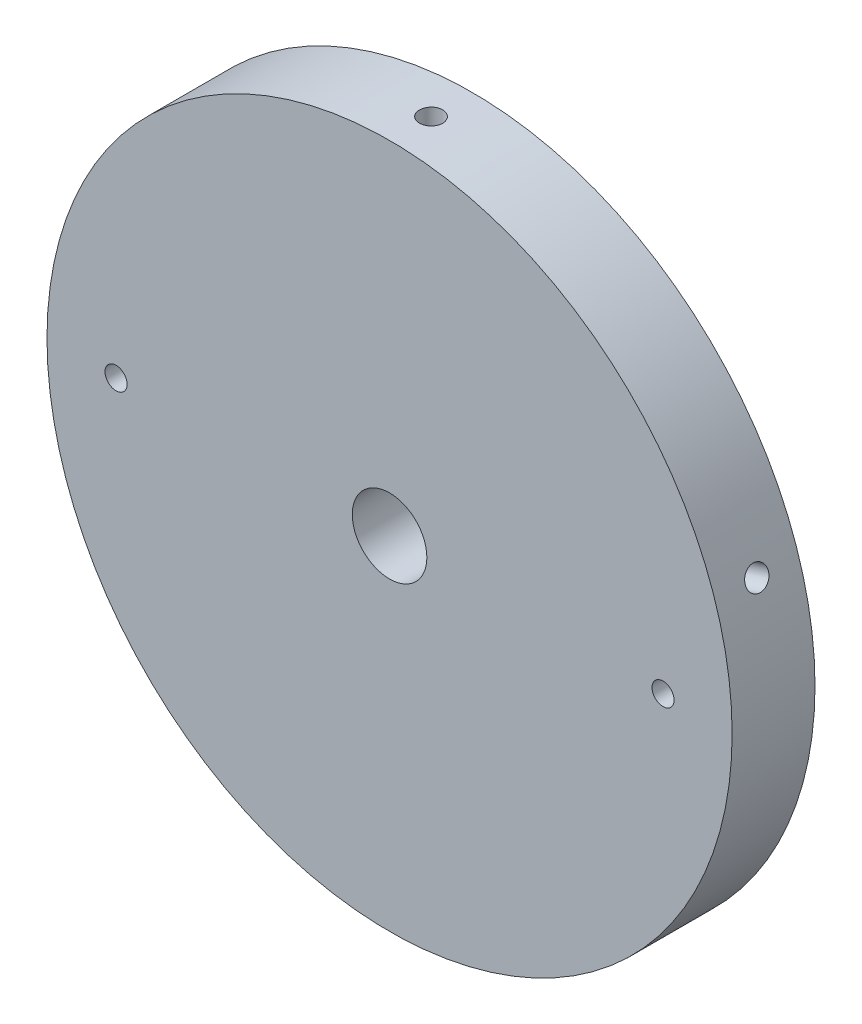
from build123d import *

# Parameters (mm, degrees)
SKETCH1_R                       = 62
BOSS_EXTRUDE1_DEPTH             = 15
M12_CLEARANCE_HOLE1_D           = 13.5
M5_TAPPED_HOLE1_D               = 4.2
M5_TAPPED_HOLE1_DEPTH           = 12.4
M5_TAPPED_HOLE1_TIP             = 1.2618073
M5_TAPPED_HOLE1_ON_FACE_2_D     = 4.2
M5_TAPPED_HOLE1_ON_FACE_2_DEPTH = 12.4
M5_TAPPED_HOLE1_ON_FACE_2_TIP   = 1.2618073
M5_TAPPED_HOLE1_ON_FACE_3_D     = 4.2
M5_TAPPED_HOLE1_ON_FACE_3_DEPTH = 12.4
M5_TAPPED_HOLE1_ON_FACE_3_TIP   = 1.2618073
M5_TAPPED_HOLE1_ON_FACE_4_D     = 4.2
M5_TAPPED_HOLE1_ON_FACE_4_DEPTH = 12.4
M5_TAPPED_HOLE1_ON_FACE_4_TIP   = 1.2618073
M5_TAPPED_HOLE1_ON_FACE_5_D     = 4.2
M5_TAPPED_HOLE1_ON_FACE_5_DEPTH = 12.4
M5_TAPPED_HOLE1_ON_FACE_5_TIP   = 1.2618073
SKETCH12_R                      = 2
CUT_EXTRUDE1_DEPTH              = 32


with BuildPart() as part:
    # Sketch1 → Boss-Extrude1 (new body)
    with BuildSketch(Plane.XY):
        Circle(SKETCH1_R)
    extrude(amount=BOSS_EXTRUDE1_DEPTH)

    # M12 Clearance Hole1 (through all)
    with Locations(Plane(origin=(0, 0, 0), x_dir=(-1, 0, 0), z_dir=(0, 0, -1))):
        with Locations((0, 0)):
            Hole(M12_CLEARANCE_HOLE1_D / 2)

    # M5 Tapped Hole1
    with Locations(Plane(origin=(0, 62, 7.5), x_dir=(1, 0, 0), z_dir=(0, 1, 0))):
        with Locations((0, 0)):
            Hole(M5_TAPPED_HOLE1_D / 2, depth=M5_TAPPED_HOLE1_DEPTH)
            with Locations((0, 0, -(M5_TAPPED_HOLE1_DEPTH + M5_TAPPED_HOLE1_TIP / 2))):  # 118° drill point
                Cone(0, M5_TAPPED_HOLE1_D / 2, M5_TAPPED_HOLE1_TIP, mode=Mode.SUBTRACT)

    # M5 Tapped Hole1 on face 2
    with Locations(Plane(origin=(58.96550401, 19.159053651, 7.5), x_dir=(-0.309016857306, 0.951056560832, 0), z_dir=(0.951056560832, 0.309016857306, 0))):
        with Locations((0, 0)):
            Hole(M5_TAPPED_HOLE1_ON_FACE_2_D / 2, depth=M5_TAPPED_HOLE1_ON_FACE_2_DEPTH)
            with Locations((0, 0, -(M5_TAPPED_HOLE1_ON_FACE_2_DEPTH + M5_TAPPED_HOLE1_ON_FACE_2_TIP / 2))):  # 118° drill point
                Cone(0, M5_TAPPED_HOLE1_ON_FACE_2_D / 2, M5_TAPPED_HOLE1_ON_FACE_2_TIP, mode=Mode.SUBTRACT)

    # M5 Tapped Hole1 on face 3
    with Locations(Plane(origin=(36.442685642, -50.159053651, 7.5), x_dir=(-0.809017116291, -0.58778508449, 0), z_dir=(0.58778508449, -0.809017116291, 0))):
        with Locations((0, 0)):
            Hole(M5_TAPPED_HOLE1_ON_FACE_3_D / 2, depth=M5_TAPPED_HOLE1_ON_FACE_3_DEPTH)
            with Locations((0, 0, -(M5_TAPPED_HOLE1_ON_FACE_3_DEPTH + M5_TAPPED_HOLE1_ON_FACE_3_TIP / 2))):  # 118° drill point
                Cone(0, M5_TAPPED_HOLE1_ON_FACE_3_D / 2, M5_TAPPED_HOLE1_ON_FACE_3_TIP, mode=Mode.SUBTRACT)

    # M5 Tapped Hole1 on face 4
    with Locations(Plane(origin=(-36.442685642, -50.159053651, 7.5), x_dir=(-0.809017116291, 0.58778508449, 0), z_dir=(-0.58778508449, -0.809017116291, 0))):
        with Locations((0, 0)):
            Hole(M5_TAPPED_HOLE1_ON_FACE_4_D / 2, depth=M5_TAPPED_HOLE1_ON_FACE_4_DEPTH)
            with Locations((0, 0, -(M5_TAPPED_HOLE1_ON_FACE_4_DEPTH + M5_TAPPED_HOLE1_ON_FACE_4_TIP / 2))):  # 118° drill point
                Cone(0, M5_TAPPED_HOLE1_ON_FACE_4_D / 2, M5_TAPPED_HOLE1_ON_FACE_4_TIP, mode=Mode.SUBTRACT)

    # M5 Tapped Hole1 on face 5
    with Locations(Plane(origin=(-58.96550401, 19.159053651, 7.5), x_dir=(-0.309016857306, -0.951056560832, 0), z_dir=(-0.951056560832, 0.309016857306, 0))):
        with Locations((0, 0)):
            Hole(M5_TAPPED_HOLE1_ON_FACE_5_D / 2, depth=M5_TAPPED_HOLE1_ON_FACE_5_DEPTH)
            with Locations((0, 0, -(M5_TAPPED_HOLE1_ON_FACE_5_DEPTH + M5_TAPPED_HOLE1_ON_FACE_5_TIP / 2))):  # 118° drill point
                Cone(0, M5_TAPPED_HOLE1_ON_FACE_5_D / 2, M5_TAPPED_HOLE1_ON_FACE_5_TIP, mode=Mode.SUBTRACT)

    # Sketch12 → Cut-Extrude1 (cut)
    with BuildSketch(Plane(origin=(0, 0, 0), x_dir=(-1, 0, 0), z_dir=(0, 0, -1))):
        with Locations((-49.5, 0)):
            Circle(SKETCH12_R)
        with Locations(Location((49.5, 0, 0), (0, 0, 180))):
            Circle(SKETCH12_R)
    extrude(amount=-CUT_EXTRUDE1_DEPTH, mode=Mode.SUBTRACT)


solid = part.part
